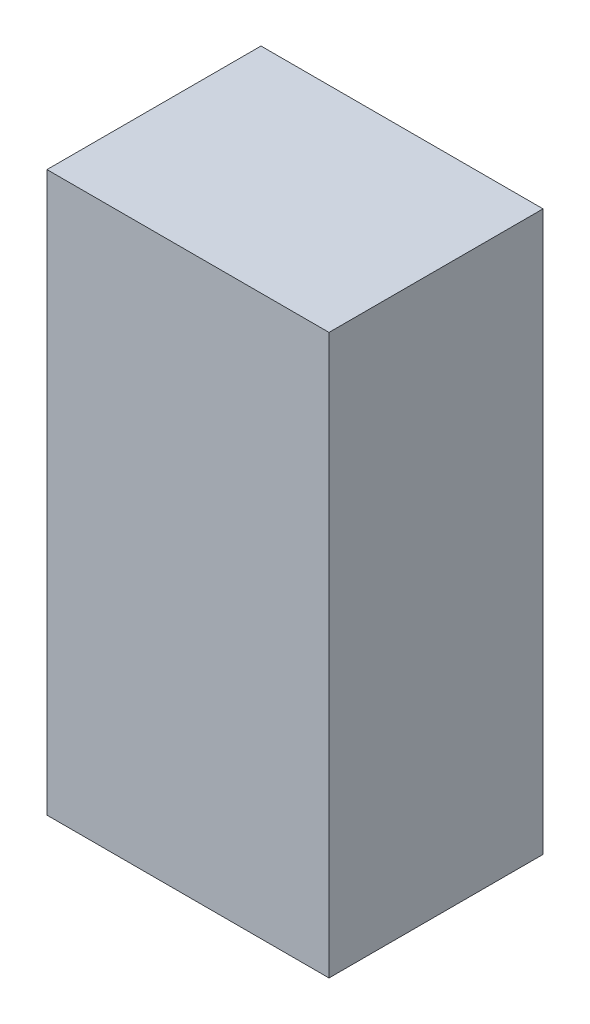
from build123d import *

# Parameters (mm, degrees)
ESBO_O1_W                = 170
ESBO_O1_H                = 337
RESSALTO_EXTRUS_O1_DEPTH = 129
ESBO_O1_5_W              = 150
ESBO_O1_5_H              = 317
CORTE_EXTRUS_O2_DEPTH    = 128


with BuildPart() as part:
    # Esboço1 → Ressalto-extrusão1 (new body)
    with BuildSketch(Plane.XY):
        Rectangle(ESBO_O1_W, ESBO_O1_H)
    extrude(amount=RESSALTO_EXTRUS_O1_DEPTH)

    # Esboço1<5> → Corte-extrusão2 (cut)
    with BuildSketch(Plane.XY):
        Rectangle(ESBO_O1_5_W, ESBO_O1_5_H)
    extrude(amount=CORTE_EXTRUS_O2_DEPTH, mode=Mode.SUBTRACT)


solid = part.part
